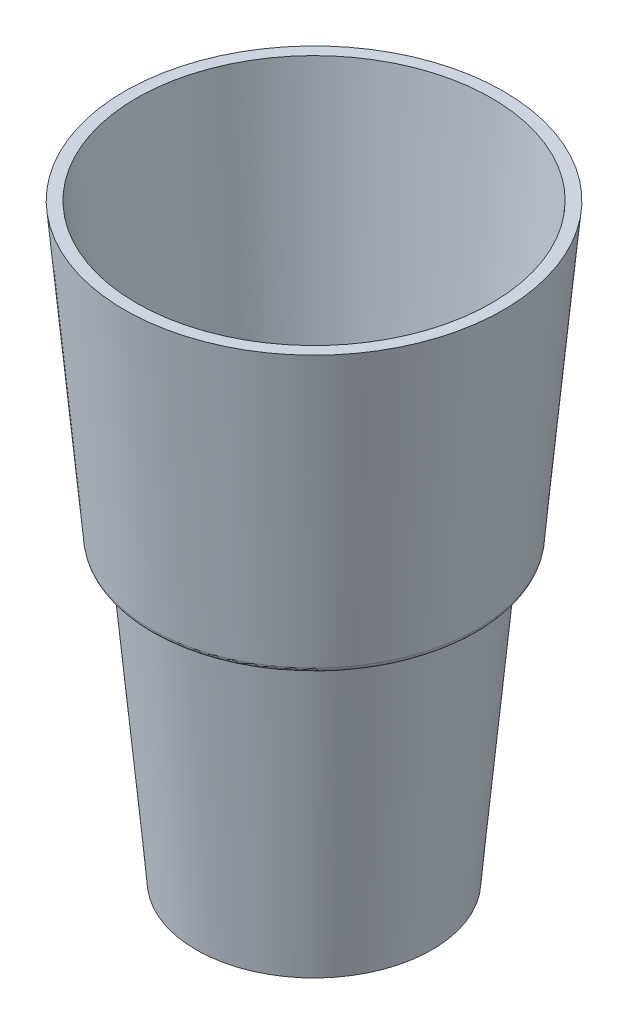
from build123d import *

# Parameters (mm, degrees)
FILLET1_R = 1.27
SHELL1_T  = -2.54


with BuildPart() as part:
    # Sketch1 → Revolve2 (revolve)
    with BuildSketch(Plane.XY, mode=Mode.PRIVATE) as revolve2_sk:
        Polygon((0, 0), (25.4, 0), (31.185877256, 63.5), (34.995877256, 63.5), (40.781754513, 127), (0, 127), align=None)
    revolve(revolve2_sk.sketch.rotate(Axis((0, 0, 0), (0, 1, 0)), 90), axis=Axis((0, 0, 0), (0, 1, 0)))

    # Fillet1
    fillet1_edges = [part.edges().sort_by_distance(p)[0] for p in [
        (0, 63.5, 34.995877256),
        (0, 63.5, 31.185877256),
    ]]
    fillet(fillet1_edges, radius=FILLET1_R)

    # Shell1
    shell1_openings = [part.faces().sort_by_distance(p)[0] for p in [
        (0, 127, 0),
    ]]
    offset(amount=SHELL1_T, openings=shell1_openings, kind=Kind.INTERSECTION)


solid = part.part
